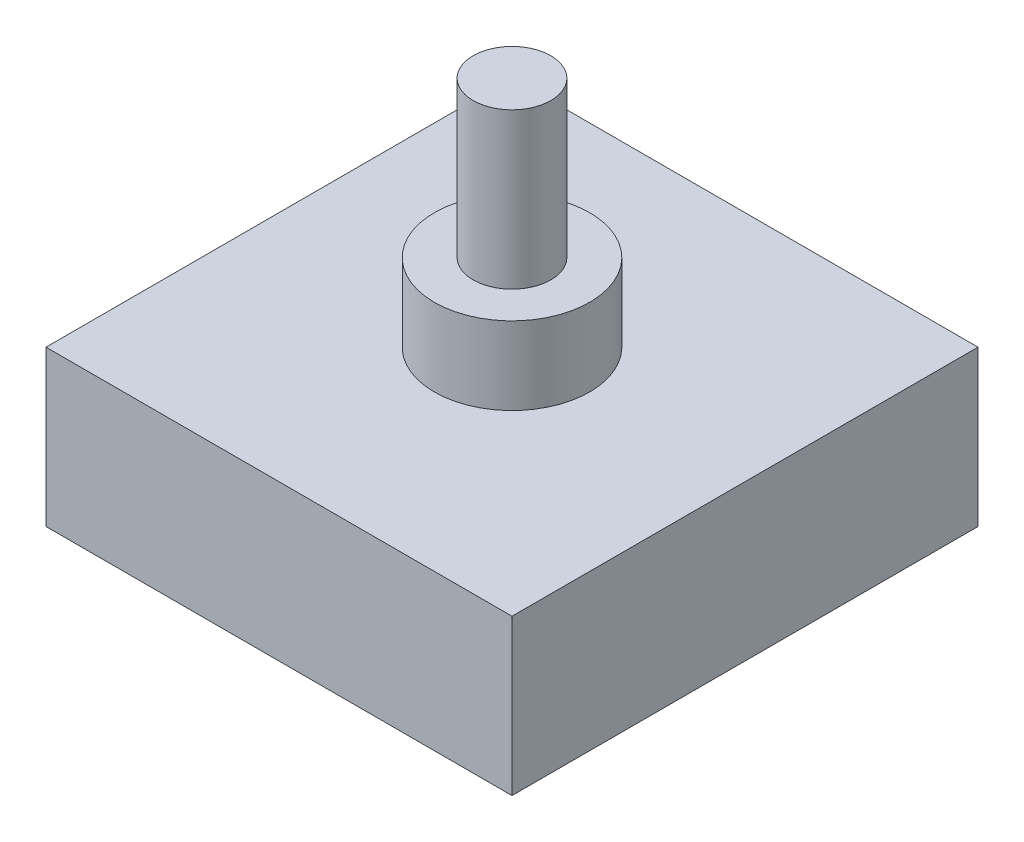
from build123d import *

# Parameters (mm, degrees)
SKETCH1_W           = 76.2
SKETCH1_H           = 76.2
BOSS_EXTRUDE1_DEPTH = 25.4
SKETCH2_R           = 12.7
BOSS_EXTRUDE2_DEPTH = 12.7
SKETCH3_R           = 6.35
BOSS_EXTRUDE3_DEPTH = 25.4


with BuildPart() as part:
    # Sketch1 → Boss-Extrude1 (new body)
    with BuildSketch(Plane(origin=(0, 0, 0), x_dir=(1, 0, 0), z_dir=(0, 1, 0))):
        with Locations((38.1, 139.7)):
            Rectangle(SKETCH1_W, SKETCH1_H)
    extrude(amount=BOSS_EXTRUDE1_DEPTH)

    # Sketch2 → Boss-Extrude2 (add)
    with BuildSketch(Plane(origin=(0, 25.4, 0), x_dir=(1, 0, 0), z_dir=(0, 1, 0))):
        with Locations(Location((38.1, 139.7, 0), (0, 0, 270))):
            Circle(SKETCH2_R)
    extrude(amount=BOSS_EXTRUDE2_DEPTH)

    # Sketch3 → Boss-Extrude3 (add)
    with BuildSketch(Plane(origin=(0, 38.1, 0), x_dir=(1, 0, 0), z_dir=(0, 1, 0))):
        with Locations(Location((38.1, 139.7, 0), (0, 0, 270))):
            Circle(SKETCH3_R)
    extrude(amount=BOSS_EXTRUDE3_DEPTH)


solid = part.part
